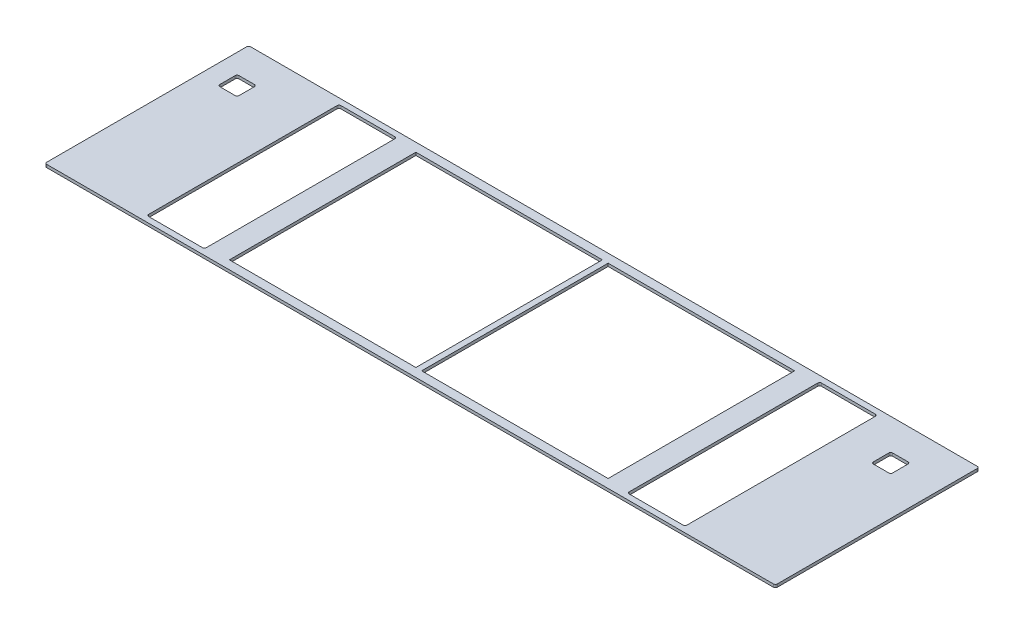
from build123d import *

# Parameters (mm, degrees)
SKETCH_1_W      = 194
SKETCH_1_H      = 194
EXTRUDE_1_DEPTH = 3


with BuildPart() as part:
    # 草图1 → 凸台-拉伸1 (new body)
    with BuildSketch(Plane(origin=(0, 0, 0), x_dir=(1, 0, 0), z_dir=(0, 1, 0))):
        with BuildLine():
            Line((2, 0), (758, 0))
            ThreePointArc((758, 0), (759.414213562, 0.585786438), (760, 2))
            Line((760, 2), (760, 210))
            ThreePointArc((760, 210), (759.414213562, 211.414213562), (758, 212))
            Line((758, 212), (2, 212))
            ThreePointArc((2, 212), (0.585786438, 211.414213562), (0, 210))
            Line((0, 210), (0, 2))
            ThreePointArc((0, 2), (0.585786438, 0.585786438), (2, 0))
        make_face()
        with Locations((480, 106)):
            Rectangle(SKETCH_1_W, SKETCH_1_H, mode=Mode.SUBTRACT)
        with Locations((280, 106)):
            Rectangle(SKETCH_1_W, SKETCH_1_H, mode=Mode.SUBTRACT)
        with BuildLine():
            Line((658, 6), (602, 6))
            ThreePointArc((602, 6), (600.585786438, 6.585786438), (600, 8))
            Line((600, 8), (600, 204))
            ThreePointArc((600, 204), (600.585786438, 205.414213562), (602, 206))
            Line((602, 206), (658, 206))
            ThreePointArc((658, 206), (659.414213562, 205.414213562), (660, 204))
            Line((660, 204), (660, 8))
            ThreePointArc((660, 8), (659.414213562, 6.585786438), (658, 6))
        make_face(mode=Mode.SUBTRACT)
        with BuildLine():
            Line((158, 6), (102, 6))
            ThreePointArc((102, 6), (100.585786438, 6.585786438), (100, 8))
            Line((100, 8), (100, 204))
            ThreePointArc((100, 204), (100.585786438, 205.414213562), (102, 206))
            Line((102, 206), (158, 206))
            ThreePointArc((158, 206), (159.414213562, 205.414213562), (160, 204))
            Line((160, 204), (160, 8))
            ThreePointArc((160, 8), (159.414213562, 6.585786438), (158, 6))
        make_face(mode=Mode.SUBTRACT)
        with BuildLine():
            Line((718, 160), (702, 160))
            ThreePointArc((702, 160), (700.585786438, 160.585786438), (700, 162))
            Line((700, 162), (700, 178))
            ThreePointArc((700, 178), (700.585786438, 179.414213562), (702, 180))
            Line((702, 180), (718, 180))
            ThreePointArc((718, 180), (719.414213562, 179.414213562), (720, 178))
            Line((720, 178), (720, 162))
            ThreePointArc((720, 162), (719.414213562, 160.585786438), (718, 160))
        make_face(mode=Mode.SUBTRACT)
        with BuildLine():
            Line((38, 160), (22, 160))
            ThreePointArc((22, 160), (20.585786438, 160.585786438), (20, 162))
            Line((20, 162), (20, 178))
            ThreePointArc((20, 178), (20.585786438, 179.414213562), (22, 180))
            Line((22, 180), (38, 180))
            ThreePointArc((38, 180), (39.414213562, 179.414213562), (40, 178))
            Line((40, 178), (40, 162))
            ThreePointArc((40, 162), (39.414213562, 160.585786438), (38, 160))
        make_face(mode=Mode.SUBTRACT)
    extrude(amount=-EXTRUDE_1_DEPTH)


solid = part.part
